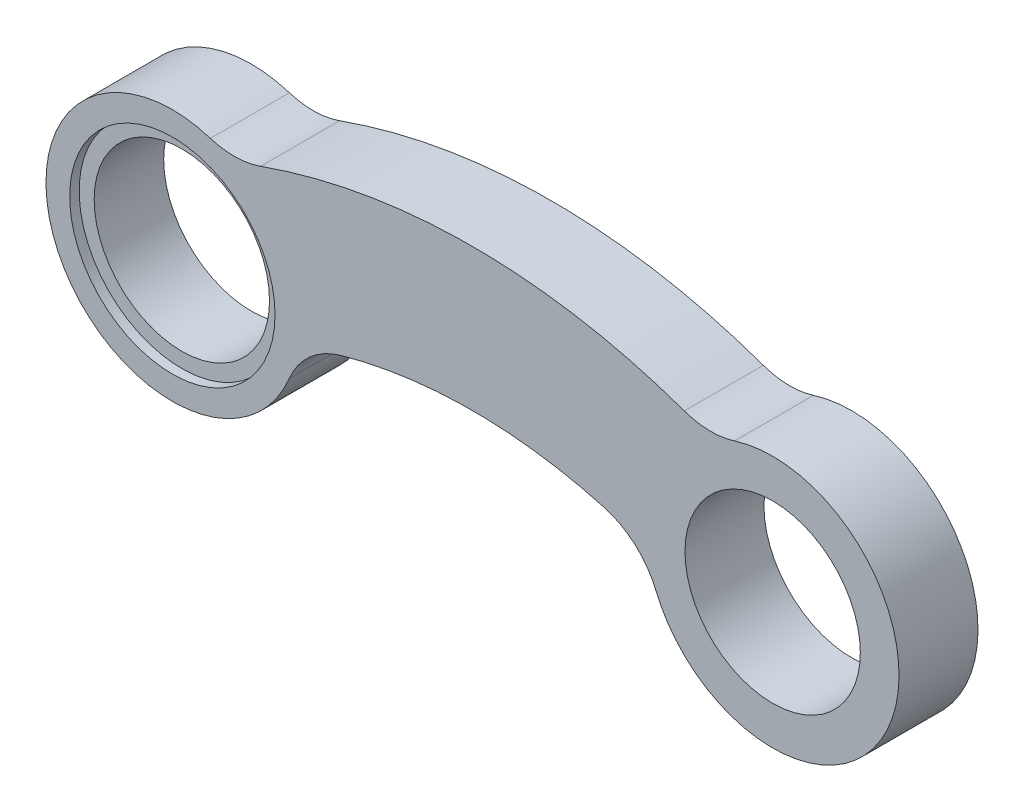
from build123d import *

# Parameters (mm, degrees)
EXTRUDE_1_DEPTH     = 5
SKETCH_3_R          = 5.55
CUT_EXTRUDE_1_DEPTH = 5
FILLET_1_R          = 5
SKETCH_4_R          = 6.5
CUT_EXTRUDE_2_DEPTH = 0.6


with BuildPart() as part:
    # 草图1 → 凸台-拉伸1 (new body)
    with BuildSketch(Plane.XY):
        with BuildLine():
            ThreePointArc((-7.931682852, -1.043267527), (7.134318966, -3.619598443), (-3.842383801, 7.016843074))
            ThreePointArc((-3.842383801, 7.016843074), (-19, 10), (-34.157616199, 7.016843074))
            ThreePointArc((-34.157616199, 7.016843074), (-45.134318966, -3.619598443), (-30.068317148, -1.043267527))
            ThreePointArc((-30.068317148, -1.043267527), (-19, 1), (-7.931682852, -1.043267527))
        make_face()
    extrude(amount=-EXTRUDE_1_DEPTH)

    # 草图3 → 切除-拉伸1 (cut)
    with BuildSketch(Plane(origin=(0, 0, -5), x_dir=(-1, 0, 0), z_dir=(0, 0, -1))):
        Circle(SKETCH_3_R)
        with Locations((38, 0)):
            Circle(SKETCH_3_R)
    extrude(amount=-CUT_EXTRUDE_1_DEPTH, mode=Mode.SUBTRACT)

    # 圆角1
    fillet_1_edges = [part.edges().sort_by_distance(p)[0] for p in [
        (-30.068317148, -1.043267527, -2.5),
        (-34.157616199, 7.016843074, -2.5),
        (-3.842383801, 7.016843074, -2.5),
        (-7.931682852, -1.043267527, -2.5),
    ]]
    fillet(fillet_1_edges, radius=FILLET_1_R)

    # 草图4 → 切除-拉伸2 (cut)
    with BuildSketch(Plane.XY):
        with Locations((-38, 0)):
            Circle(SKETCH_4_R)
    extrude(amount=-CUT_EXTRUDE_2_DEPTH, mode=Mode.SUBTRACT)


solid = part.part
